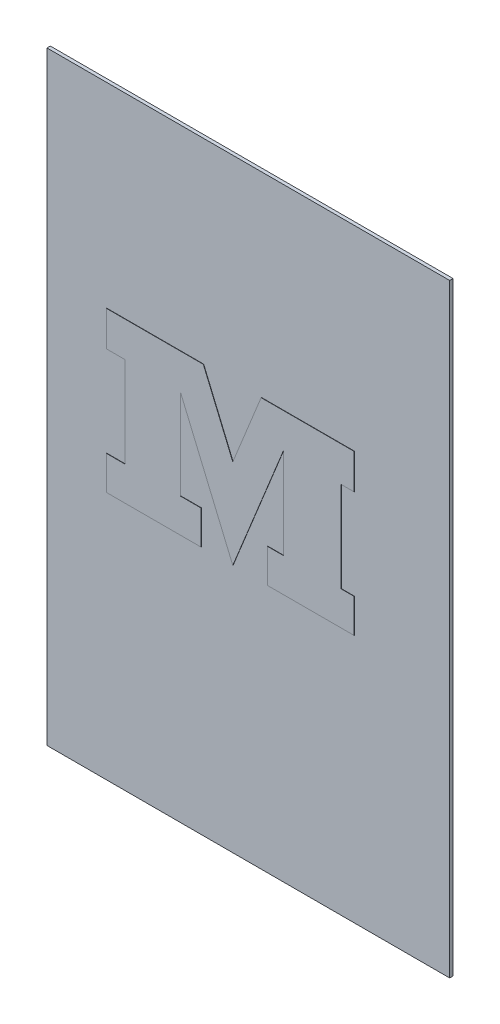
from build123d import *

# Parameters (mm, degrees)
SKETCH1_W           = 304.8
SKETCH1_H           = 457.2
BOSS_EXTRUDE1_DEPTH = 2.54
BOSS_EXTRUDE2_DEPTH = 0.254


with BuildPart() as part:
    # Sketch1 → Boss-Extrude1 (new body)
    with BuildSketch(Plane.XY):
        with Locations((152.4, 228.6)):
            Rectangle(SKETCH1_W, SKETCH1_H)
    extrude(amount=BOSS_EXTRUDE1_DEPTH)

    # Sketch2 → Boss-Extrude2 (add)
    with BuildSketch(Plane.XY.offset(2.54)):
        Polygon((76.582640735, 188.599807008), (116.844272896, 188.599807008), (116.844272896, 214.220845657), (101.157922704, 214.220845657), (101.157922704, 282.717908165), (140.896676525, 188.599807008), (179.13215512, 282.717908165), (179.13215512, 214.220845657), (167.067091951, 214.220845657), (167.067091951, 188.599807008), (232.753082879, 188.599807008), (232.753082879, 214.220845657), (222.900184239, 214.220845657), (222.900184239, 282.717908165), (232.753082879, 282.717908165), (232.753082879, 309.27172291), (222.900184239, 309.27172291), (162.34351535, 309.27172291), (140.896676525, 256.479504264), (118.606628652, 309.27172291), (59.196762562, 309.27172291), (45.234909284, 309.27172291), (45.234909284, 282.717908165), (59.196762562, 282.717908165), (59.196762562, 214.220845657), (45.234909284, 214.220845657), (45.234909284, 188.599807008), align=None)
    extrude(amount=BOSS_EXTRUDE2_DEPTH)


solid = part.part
